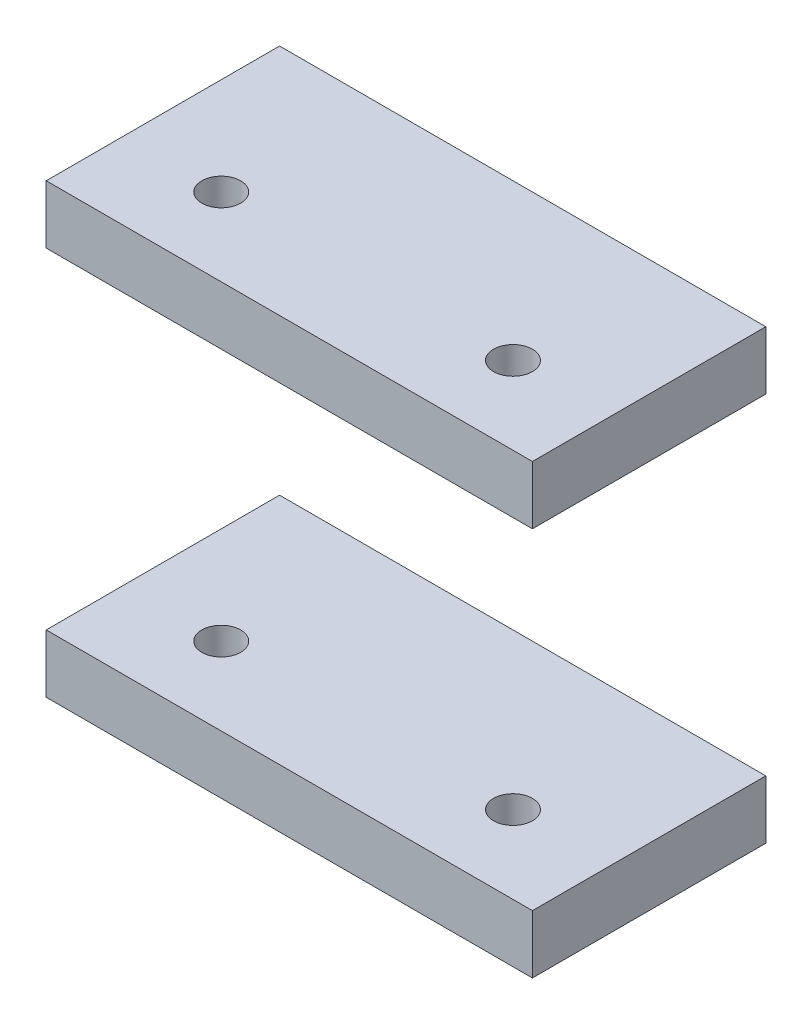
from build123d import *

# Parameters (mm, degrees)
SKETCH_1_W          = 50
SKETCH_1_H          = 6
EXTRUDE_1_DEPTH     = 24
EXTRUDE_1_2_DEPTH   = 24
SKETCH_2_R          = 2
CUT_EXTRUDE_1_DEPTH = 58.5934024


with BuildPart() as part:
    # 草图1 → 凸台-拉伸1 (new body)
    with BuildSketch(Plane.XY):
        with Locations((0, -20)):
            Rectangle(SKETCH_1_W, SKETCH_1_H)
    extrude(amount=EXTRUDE_1_DEPTH)


with BuildPart() as body_2:
    # 草图1 → Extrude 1 2 (new body)
    with BuildSketch(Plane.XY):
        with Locations((0, 20)):
            Rectangle(SKETCH_1_W, SKETCH_1_H)
    extrude(amount=EXTRUDE_1_2_DEPTH)


with BuildPart() as cut_extrude_1_tool:
    # 草图2 → 切除-拉伸1 (new, through all)
    with BuildSketch(Plane.XZ.offset(23)):
        with Locations(Location((-15, 16, 0), (0, 0, 270))):
            Circle(SKETCH_2_R)
        with Locations(Location((15, 16, 0), (0, 0, 270))):
            Circle(SKETCH_2_R)
    extrude(amount=-CUT_EXTRUDE_1_DEPTH)


with BuildPart() as part_1:
    add(part.part)

    # 切除-拉伸1: cut by cut_extrude_1_tool
    add(cut_extrude_1_tool.part, mode=Mode.SUBTRACT)


with BuildPart() as body_2_1:
    add(body_2.part)

    # 切除-拉伸1: cut by cut_extrude_1_tool
    add(cut_extrude_1_tool.part, mode=Mode.SUBTRACT)


solid = Compound([part_1.part, body_2_1.part])
